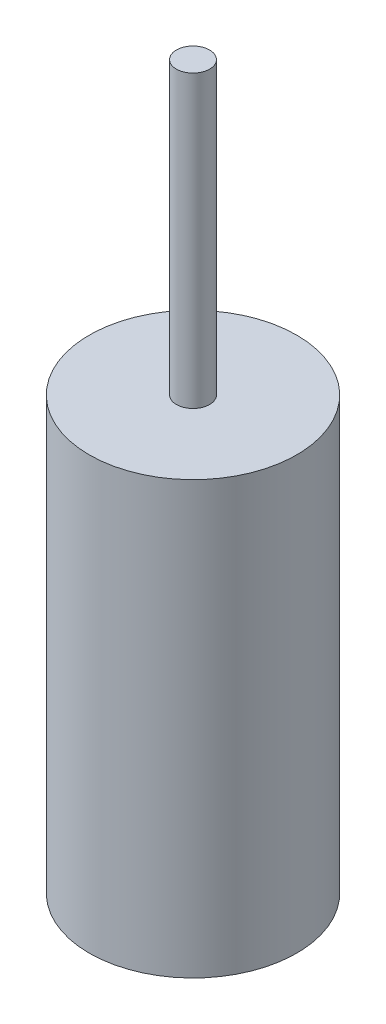
from build123d import *

# Parameters (mm, degrees)
SKETCH1_R           = 12.5
BOSS_EXTRUDE1_DEPTH = 52
SKETCH2_R           = 2
BOSS_EXTRUDE2_DEPTH = 35


with BuildPart() as part:
    # Sketch1 → Boss-Extrude1 (new body)
    with BuildSketch(Plane(origin=(0, 0, 0), x_dir=(1, 0, 0), z_dir=(0, 1, 0))):
        with Locations(Location((0, 0, 0), (0, 0, 90))):
            Circle(SKETCH1_R)
    extrude(amount=BOSS_EXTRUDE1_DEPTH)

    # Sketch2 → Boss-Extrude2 (add)
    with BuildSketch(Plane(origin=(0, 52, 0), x_dir=(1, 0, 0), z_dir=(0, 1, 0))):
        with Locations(Location((0, 0, 0), (0, 0, 270))):
            Circle(SKETCH2_R)
    extrude(amount=BOSS_EXTRUDE2_DEPTH)


solid = part.part
